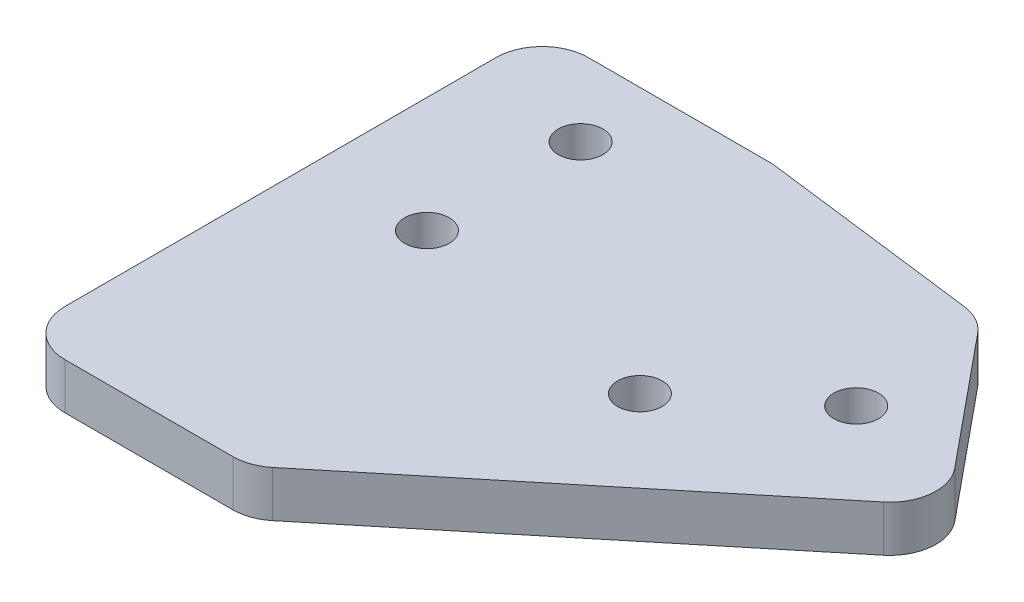
from build123d import *

# Parameters (mm, degrees)
SKETCH_1_R      = 1.45
EXTRUDE_1_DEPTH = 3
FILLET_1_R      = 3


with BuildPart() as part:
    # 草图1 → 凸台-拉伸1 (new body)
    with BuildSketch(Plane(origin=(0, 0, 0), x_dir=(1, 0, 0), z_dir=(0, 1, 0))):
        Polygon((-200, 25), (-185, 25), (-169.545454545, 23.052363238), (-160.024381788, 11.461454148), (-175.478927243, -1.233309529), (-185, -9.054165144), (-200, -9.054165144), (-200, -4.917341068), align=None)
        with Locations(Location((-176.375827258, 7.735835936, 0), (0, 0, 270))):
            Circle(SKETCH_1_R, mode=Mode.SUBTRACT)
        with Locations(Location((-168.648554531, 14.083217774, 0), (0, 0, 270))):
            Circle(SKETCH_1_R, mode=Mode.SUBTRACT)
        with Locations(Location((-192.5, 20, 0), (0, 0, 270))):
            Circle(SKETCH_1_R, mode=Mode.SUBTRACT)
        with Locations(Location((-192.5, 10, 0), (0, 0, 270))):
            Circle(SKETCH_1_R, mode=Mode.SUBTRACT)
    extrude(amount=EXTRUDE_1_DEPTH)

    # 圆角1
    fillet_1_edges = [part.edges().sort_by_distance(p)[0] for p in [
        (-185, 1.5, 9.054165144),
        (-200, 1.5, 9.054165144),
        (-200, 1.5, -25),
        (-185, 1.5, -25),
        (-169.545454545, 1.5, -23.052363238),
        (-160.024381788, 1.5, -11.461454148),
    ]]
    fillet(fillet_1_edges, radius=FILLET_1_R)


solid = part.part
